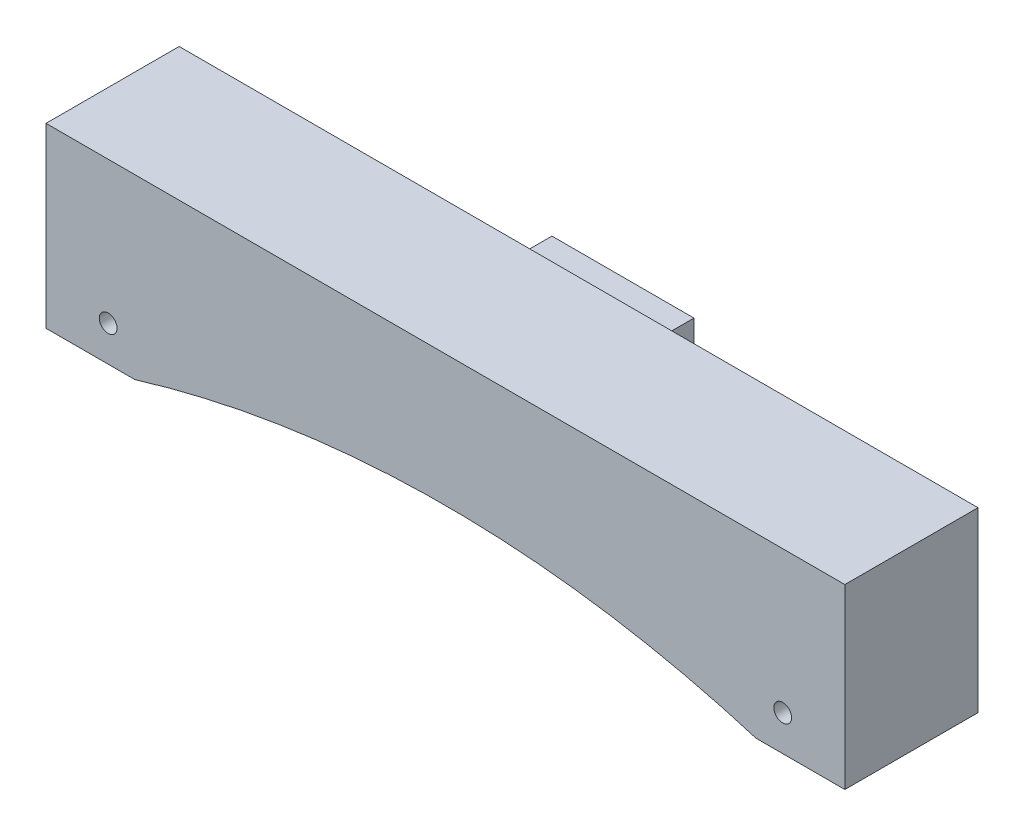
from build123d import *

# Parameters (mm, degrees)
BOSS_EXTRUDE1_DEPTH = 15
SKETCH2_R           = 1
CUT_EXTRUDE1_DEPTH  = 5
SKETCH3_W           = 16
SKETCH3_H           = 9
SKETCH3_W_2         = 15
SKETCH3_H_2         = 8
BOSS_EXTRUDE2_DEPTH = 5
SKETCH4_R           = 1
CUT_EXTRUDE2_DEPTH  = 5


with BuildPart() as part:
    # Sketch1 → Boss-Extrude1 (new body)
    with BuildSketch(Plane.XY):
        with BuildLine():
            Line((0, 0), (90, 0))
            Line((90, 0), (90, -20))
            Line((90, -20), (80, -20))
            ThreePointArc((80, -20), (45, -14.782402832), (10, -20))
            Line((10, -20), (0, -20))
            Line((0, -20), (0, 0))
        make_face()
    extrude(amount=BOSS_EXTRUDE1_DEPTH)

    # Sketch2 → Cut-Extrude1 (cut)
    with BuildSketch(Plane.XY.offset(15)):
        with Locations((7, -16)):
            Circle(SKETCH2_R)
        with Locations((83, -16)):
            Circle(SKETCH2_R)
    extrude(amount=-CUT_EXTRUDE1_DEPTH, mode=Mode.SUBTRACT)

    # Sketch3 → Boss-Extrude2 (add)
    with BuildSketch(Plane(origin=(0, 0, 0), x_dir=(-1, 0, 0), z_dir=(0, 0, -1))):
        with Locations((-45, -7)):
            Rectangle(SKETCH3_W, SKETCH3_H)
        with Locations((-45, -7)):
            Rectangle(SKETCH3_W_2, SKETCH3_H_2, mode=Mode.SUBTRACT)
    extrude(amount=BOSS_EXTRUDE2_DEPTH)

    # Sketch4 → Cut-Extrude2 (cut)
    with BuildSketch(Plane(origin=(0, 0, 0), x_dir=(-1, 0, 0), z_dir=(0, 0, -1))):
        with Locations((-45, -7)):
            Circle(SKETCH4_R)
    extrude(amount=-CUT_EXTRUDE2_DEPTH, mode=Mode.SUBTRACT)


solid = part.part
